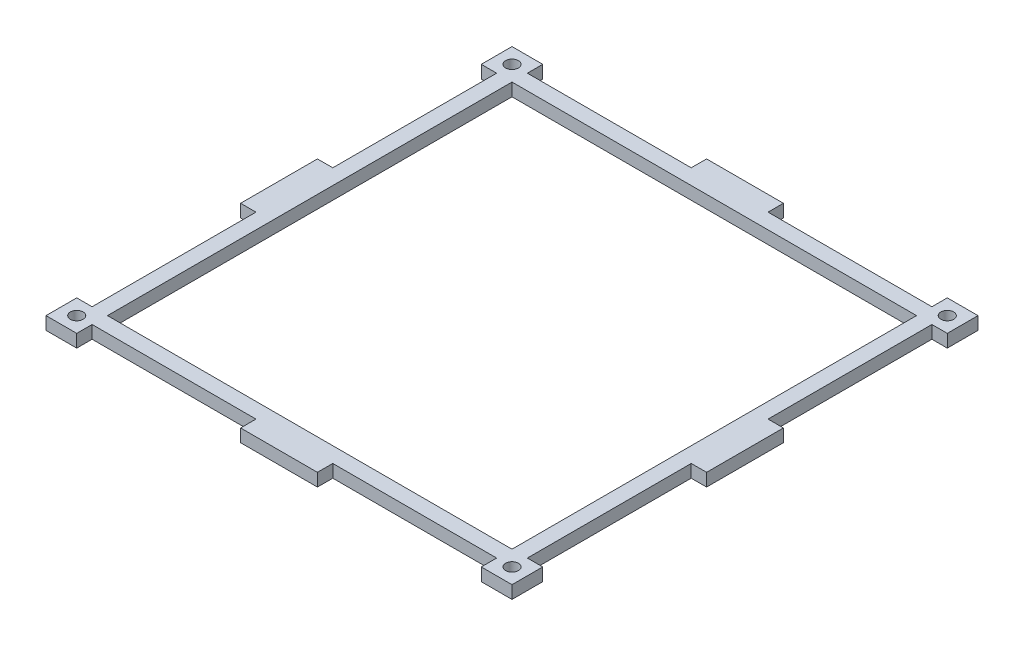
from build123d import *

# Parameters (mm, degrees)
CROQUIS1_R              = 2.5
SALIENTE_EXTRUIR1_DEPTH = 5


with BuildPart() as part:
    # Croquis1 → Saliente-Extruir1 (new body)
    # profile 1 of 4: a face of its own
    with BuildSketch(Plane(origin=(0, 0, 0), x_dir=(1, 0, 0), z_dir=(0, 1, 0))):
        Polygon((0, 79), (0, 91), (15, 91), (15, 85), (79, 85), (79, 91), (91, 91), (91, 79), (85, 79), (85, 15), (91, 15), (91, 0), (79, 0), (79, 79), align=None)
        with Locations(Location((85, 85, 0), (0, 0, 270))):
            Circle(CROQUIS1_R, mode=Mode.SUBTRACT)
    # profile 2 of 4: a face of its own
    with BuildSketch(Plane(origin=(0, 0, 0), x_dir=(1, 0, 0), z_dir=(0, 1, 0))):
        Polygon((79, 0), (91, 0), (91, -15), (85, -15), (85, -79), (91, -79), (91, -91), (79, -91), (79, -85), (15, -85), (15, -91), (0, -91), (0, -79), (79, -79), align=None)
        with Locations(Location((85, -85, 0), (0, 0, 270))):
            Circle(CROQUIS1_R, mode=Mode.SUBTRACT)
    # profile 3 of 4: a face of its own
    with BuildSketch(Plane(origin=(0, 0, 0), x_dir=(1, 0, 0), z_dir=(0, 1, 0))):
        Polygon((0, -79), (0, -91), (-15, -91), (-15, -85), (-79, -85), (-79, -91), (-91, -91), (-91, -79), (-85, -79), (-85, -15), (-91, -15), (-91, 0), (-79, 0), (-79, -79), align=None)
        with Locations(Location((-85, -85, 0), (0, 0, 270))):
            Circle(CROQUIS1_R, mode=Mode.SUBTRACT)
    # profile 4 of 4: a face of its own
    with BuildSketch(Plane(origin=(0, 0, 0), x_dir=(1, 0, 0), z_dir=(0, 1, 0))):
        Polygon((0, 79), (-79, 79), (-79, 0), (-91, 0), (-91, 15), (-85, 15), (-85, 79), (-91, 79), (-91, 91), (-79, 91), (-79, 85), (-15, 85), (-15, 91), (0, 91), align=None)
        with Locations(Location((-85, 85, 0), (0, 0, 270))):
            Circle(CROQUIS1_R, mode=Mode.SUBTRACT)
    extrude(amount=SALIENTE_EXTRUIR1_DEPTH)


solid = part.part
